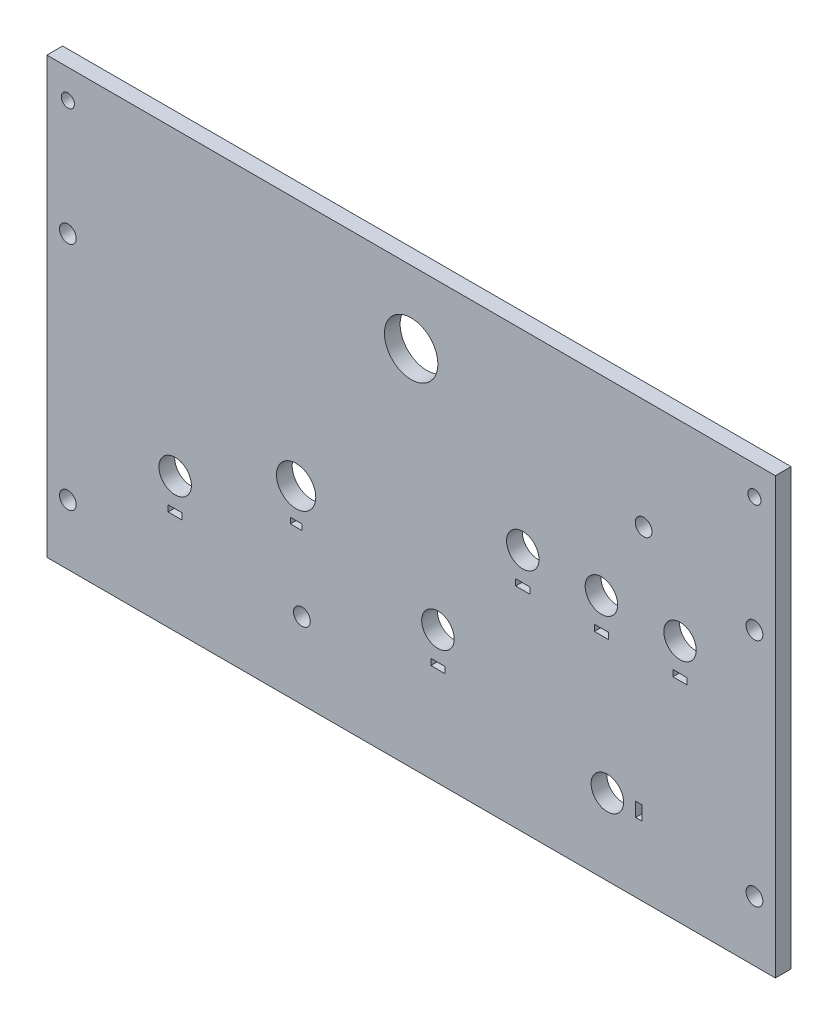
from build123d import *

# Parameters (mm, degrees)
SKETCH1_W           = 139
SKETCH1_H           = 83
SKETCH1_R           = 1.6
SKETCH1_R_2         = 3.1
SKETCH1_R_3         = 1.25
SKETCH1_R_4         = 3.75
SKETCH1_R_5         = 5.1
SKETCH1_W_2         = 2.7
SKETCH1_H_2         = 1.2
SKETCH1_W_3         = 1.2
SKETCH1_H_3         = 2.7
SKETCH1_W_4         = 2.2
SKETCH1_H_4         = 1.1
BOSS_EXTRUDE1_DEPTH = 3


with BuildPart() as part:
    # Sketch1 → Boss-Extrude1 (new body)
    with BuildSketch(Plane.XY):
        with Locations((69.5, 41.5)):
            Rectangle(SKETCH1_W, SKETCH1_H)
        with Locations((4, 55.5)):
            Circle(SKETCH1_R, mode=Mode.SUBTRACT)
        with Locations((135, 55.5)):
            Circle(SKETCH1_R, mode=Mode.SUBTRACT)
        with Locations((135, 11.5)):
            Circle(SKETCH1_R, mode=Mode.SUBTRACT)
        with Locations((4, 11.5)):
            Circle(SKETCH1_R, mode=Mode.SUBTRACT)
        with Locations((48.65436543, 14.544998484)):
            Circle(SKETCH1_R, mode=Mode.SUBTRACT)
        with Locations((24.475038928, 25.666634818)):
            Circle(SKETCH1_R_2, mode=Mode.SUBTRACT)
        with Locations((135, 77.5)):
            Circle(SKETCH1_R_3, mode=Mode.SUBTRACT)
        with Locations((4, 77.5)):
            Circle(SKETCH1_R_3, mode=Mode.SUBTRACT)
        with Locations((74.615565323, 25.361106272)):
            Circle(SKETCH1_R_2, mode=Mode.SUBTRACT)
        with Locations((106.932598637, 14.544998484)):
            Circle(SKETCH1_R_2, mode=Mode.SUBTRACT)
        with Locations((47.55436543, 35.562774654)):
            Circle(SKETCH1_R_4, mode=Mode.SUBTRACT)
        with Locations((69.5, 69.231811206)):
            Circle(SKETCH1_R_5, mode=Mode.SUBTRACT)
        with Locations((113.858121324, 61.952726152)):
            Circle(SKETCH1_R, mode=Mode.SUBTRACT)
        with Locations((90.80059856, 46.596907859)):
            Circle(SKETCH1_R_2, mode=Mode.SUBTRACT)
        with Locations((105.80059856, 46.596907859)):
            Circle(SKETCH1_R_2, mode=Mode.SUBTRACT)
        with Locations((120.80059856, 46.596907859)):
            Circle(SKETCH1_R_2, mode=Mode.SUBTRACT)
        with Locations((74.615565323, 19.361106272)):
            Rectangle(SKETCH1_W_2, SKETCH1_H_2, mode=Mode.SUBTRACT)
        with Locations((24.475038928, 19.666634818)):
            Rectangle(SKETCH1_W_2, SKETCH1_H_2, mode=Mode.SUBTRACT)
        with Locations((112.932598637, 14.544998484)):
            Rectangle(SKETCH1_W_3, SKETCH1_H_3, mode=Mode.SUBTRACT)
        with Locations((47.55436543, 29.312774654)):
            Rectangle(SKETCH1_W_4, SKETCH1_H_4, mode=Mode.SUBTRACT)
        with Locations((90.80059856, 40.596907859)):
            Rectangle(SKETCH1_W_2, SKETCH1_H_2, mode=Mode.SUBTRACT)
        with Locations((105.80059856, 40.596907859)):
            Rectangle(SKETCH1_W_2, SKETCH1_H_2, mode=Mode.SUBTRACT)
        with Locations((120.80059856, 40.596907859)):
            Rectangle(SKETCH1_W_2, SKETCH1_H_2, mode=Mode.SUBTRACT)
    extrude(amount=BOSS_EXTRUDE1_DEPTH)


solid = part.part
